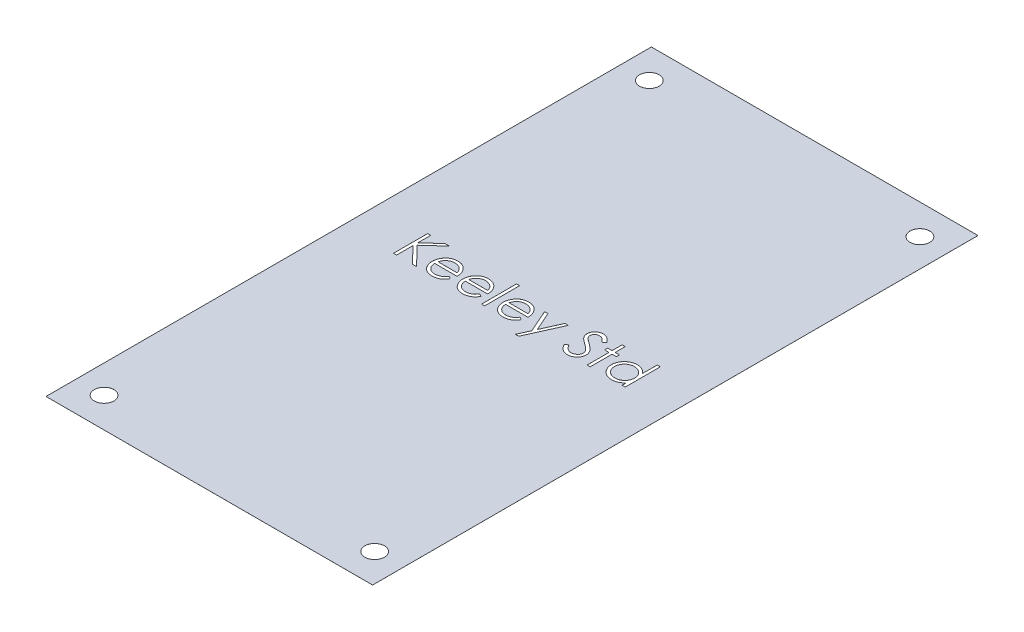
from build123d import *

# Parameters (mm, degrees)
SKETCH2_W           = 60.706
SKETCH2_H           = 112.522
BOSS_EXTRUDE1_DEPTH = 0.00254
SKETCH3_R           = 1.8288
CUT_EXTRUDE1_DEPTH  = 64.926557364
SKETCH5_W           = 0.569871795
SKETCH5_H           = 6.512820513
CUT_EXTRUDE2_DEPTH  = 2.54


with BuildPart() as part:
    # Sketch2 → Boss-Extrude1 (new body)
    with BuildSketch(Plane(origin=(0, 0, 0), x_dir=(1, 0, 0), z_dir=(0, 1, 0))):
        Rectangle(SKETCH2_W, SKETCH2_H)
    extrude(amount=BOSS_EXTRUDE1_DEPTH)

    # Sketch3 → Cut-Extrude1 (cut, through all)
    with BuildSketch(Plane(origin=(0, 0.00254, 0), x_dir=(1, 0, 0), z_dir=(0, 1, 0))):
        with Locations(Location((-25.146, 50.673, 0), (0, 0, 270))):
            Circle(SKETCH3_R)
        with Locations(Location((25.146, 50.673, 0), (0, 0, 270))):
            Circle(SKETCH3_R)
        with Locations(Location((25.146, -50.673, 0), (0, 0, 270))):
            Circle(SKETCH3_R)
        with Locations(Location((-25.146, -50.673, 0), (0, 0, 270))):
            Circle(SKETCH3_R)
    extrude(amount=-CUT_EXTRUDE1_DEPTH, mode=Mode.SUBTRACT)

    # Sketch5 → Cut-Extrude2 (cut)
    # profile 1 of 9: a face of its own
    with BuildSketch(Plane(origin=(0, 0.00254, 0), x_dir=(1, 0, 0), z_dir=(0, 1, 0))):
        Polygon((-21.106420198, 5.433262099), (-20.536548403, 5.433262099), (-20.536548403, 3.015123076), (-17.889443034, 5.433262099), (-17.076612505, 5.433262099), (-20.196914989, 2.583903125), (-16.832381736, -0.916737901), (-17.591786784, -0.916737901), (-20.536548403, 2.147595032), (-20.536548403, -0.916737901), (-21.106420198, -0.916737901), align=None)
    # profile 2 of 9: a face of its own
    with BuildSketch(Plane(origin=(0, 0.00254, 0), x_dir=(1, 0, 0), z_dir=(0, 1, 0))):
        with BuildLine():
            Line((-12.250510742, 0.548646714), (-11.74424071, 0.282791346))
            add(Edge.make_bspline(
                [(-11.74424071, 0.282791346), (-11.784584248, 0.211229873), (-11.863076794, 0.071999587), (-11.998061008, -0.119283932), (-12.139560911, -0.291364787), (-12.293963825, -0.439645732), (-12.456650242, -0.568916102), (-12.628522345, -0.682014726), (-12.810474914, -0.778386899), (-13.002516557, -0.859580771), (-13.206260029, -0.922009425), (-13.422199066, -0.966104225), (-13.65074735, -0.993360727), (-13.807403991, -0.996526911), (-13.887620117, -0.998148158)],
                knots=[0, 0, 0, 0, 1.120438281, 2.179929193, 3.190490725, 4.156257408, 5.095198341, 6.022838206, 6.959905092, 7.901321166, 8.864066838, 9.862729781, 10.905609505, 12, 12, 12, 12], degree=3))
            add(Edge.make_bspline(
                [(-13.887620117, -0.998148158), (-13.976777705, -0.996066854), (-14.15069833, -0.992006833), (-14.4038633, -0.95700479), (-14.642223102, -0.89990494), (-14.865764335, -0.820138886), (-15.073939565, -0.715949312), (-15.267162544, -0.589022824), (-15.446449398, -0.440011447), (-15.606150463, -0.267624471), (-15.749921508, -0.083144349), (-15.876786924, 0.109089899), (-15.982845406, 0.308594606), (-16.069119427, 0.5140997), (-16.138796825, 0.724309907), (-16.187359274, 0.941137855), (-16.215353245, 1.163996701), (-16.219643025, 1.31475901), (-16.221804813, 1.390734054)],
                knots=[0, 0, 0, 0, 1.145258523, 2.234067595, 3.276747158, 4.290159414, 5.277019952, 6.260822364, 7.254936242, 8.264827045, 9.274100331, 10.257902744, 11.220704747, 12.172965371, 13.118907548, 14.062713208, 15.023725156, 16, 16, 16, 16], degree=3))
            add(Edge.make_bspline(
                [(-16.221804813, 1.390734054), (-16.219883228, 1.462026103), (-16.2160749, 1.603317531), (-16.192070472, 1.812442162), (-16.149528569, 2.015693783), (-16.091151524, 2.213241281), (-16.015765691, 2.404753896), (-15.923541522, 2.590348182), (-15.814335351, 2.769826651), (-15.730020643, 2.883043765), (-15.687550005, 2.940072996)],
                knots=[0, 0, 0, 0, 1.024358464, 2.0301432, 3.019427413, 4.004406732, 4.986367066, 5.972626655, 6.978780325, 8, 8, 8, 8], degree=3))
            add(Edge.make_bspline(
                [(-15.687550005, 2.940072996), (-15.630023209, 3.008777946), (-15.516791921, 3.144011448), (-15.325282533, 3.321699553), (-15.11790932, 3.470550402), (-14.897271084, 3.593934778), (-14.660803481, 3.687685538), (-14.411685196, 3.757549294), (-14.147079632, 3.796697971), (-13.966185874, 3.802227612), (-13.87362773, 3.805056971)],
                knots=[0, 0, 0, 0, 1.030682036, 2.02871468, 2.997146059, 3.962720338, 4.930598197, 5.918074684, 6.934738563, 8, 8, 8, 8], degree=3))
            add(Edge.make_bspline(
                [(-13.87362773, 3.805056971), (-13.778472789, 3.802600339), (-13.591800485, 3.797780988), (-13.319599351, 3.753101783), (-13.062042051, 3.682249291), (-12.819231651, 3.582184557), (-12.591143532, 3.453080799), (-12.379260271, 3.293166315), (-12.179958241, 3.107350642), (-12.064009819, 2.964451677), (-12.005007938, 2.891735657)],
                knots=[0, 0, 0, 0, 1.056321875, 2.072262726, 3.055038591, 4.01806755, 4.982017516, 5.957941055, 6.960871419, 8, 8, 8, 8], degree=3))
            add(Edge.make_bspline(
                [(-12.005007938, 2.891735657), (-11.96486335, 2.83693773), (-11.884841388, 2.727706629), (-11.784607364, 2.549596101), (-11.697598947, 2.363249737), (-11.628052004, 2.165655341), (-11.57173748, 1.959154103), (-11.530994395, 1.742269772), (-11.507100944, 1.515066933), (-11.502404307, 1.360260182), (-11.500009941, 1.281339022)],
                knots=[0, 0, 0, 0, 0.94817472, 1.890038105, 2.849395472, 3.817997239, 4.812318967, 5.836947057, 6.897266129, 8, 8, 8, 8], degree=3))
            Line((-11.500009941, 1.281339022), (-15.651933018, 1.281339022))
            add(Edge.make_bspline(
                [(-15.651933018, 1.281339022), (-15.649139732, 1.220196751), (-15.643646848, 1.099962941), (-15.618037945, 0.924030235), (-15.577672313, 0.7564386), (-15.520941299, 0.598445081), (-15.452240023, 0.447986135), (-15.36808308, 0.306177868), (-15.267681317, 0.173666195), (-15.155693263, 0.049265817), (-15.031038961, -0.06151585), (-14.899897406, -0.160669787), (-14.760390509, -0.243774226), (-14.613618272, -0.311229169), (-14.459818033, -0.364036343), (-14.298941336, -0.400082246), (-14.131304754, -0.42422514), (-14.017030636, -0.426909675), (-13.958854092, -0.428276363)],
                knots=[0, 0, 0, 0, 1.094153842, 2.151609401, 3.174256925, 4.172055639, 5.149267565, 6.128595816, 7.11444997, 8.118368179, 9.117203808, 10.09244225, 11.054858984, 12.015122123, 12.976791628, 13.957293641, 14.960065497, 16, 16, 16, 16], degree=3))
            add(Edge.make_bspline(
                [(-13.958854092, -0.428276363), (-13.901974153, -0.427173174), (-13.789113442, -0.424984237), (-13.621036458, -0.403699198), (-13.455683315, -0.369281698), (-13.293738389, -0.322309859), (-13.138488425, -0.265020427), (-12.994714356, -0.195890957), (-12.862488822, -0.119419274), (-12.738905182, -0.031953149), (-12.619033523, 0.075104562), (-12.500120726, 0.208700798), (-12.372618798, 0.366702456), (-12.292809108, 0.485621021), (-12.250510742, 0.548646714)],
                knots=[0, 0, 0, 0, 0.99110716, 1.966546729, 2.947904876, 3.932708344, 4.903319531, 5.828989031, 6.710028674, 7.56322171, 8.463672341, 9.504779593, 10.677557249, 12, 12, 12, 12], degree=3))
        make_face()
        with BuildLine():
            add(Edge.make_bspline(
                [(-12.069881736, 1.851210817), (-12.090739898, 1.926799173), (-12.130885145, 2.072282428), (-12.21477112, 2.273742329), (-12.309243773, 2.452790378), (-12.4210432, 2.608056284), (-12.547714316, 2.745948372), (-12.694027719, 2.866450662), (-12.858104268, 2.974250895), (-13.039095852, 3.065241858), (-13.230760234, 3.142693459), (-13.431431468, 3.194627597), (-13.63618774, 3.23020491), (-13.774679945, 3.233517992), (-13.844370919, 3.235185176)],
                knots=[0, 0, 0, 0, 1.154881502, 2.222775134, 3.210006277, 4.132804581, 5.035138423, 5.962687519, 6.919655026, 7.923214229, 8.944639381, 9.960483929, 10.97369054, 12, 12, 12, 12], degree=3))
            add(Edge.make_bspline(
                [(-13.844370919, 3.235185176), (-13.901247757, 3.234075429), (-14.013681309, 3.231881692), (-14.179327533, 3.211071601), (-14.338403558, 3.176673025), (-14.492083151, 3.129565175), (-14.638352441, 3.066775282), (-14.780220092, 2.993145714), (-14.914078811, 2.903263126), (-14.997792304, 2.834757775), (-15.04008406, 2.800149118)],
                knots=[0, 0, 0, 0, 1.04873581, 2.073130211, 3.073294108, 4.04793562, 5.032784715, 6.005352987, 6.992311501, 8, 8, 8, 8], degree=3))
            add(Edge.make_bspline(
                [(-15.04008406, 2.800149118), (-15.070370443, 2.772763717), (-15.131662701, 2.717342339), (-15.213560504, 2.621857922), (-15.29197479, 2.518894373), (-15.363337274, 2.404512504), (-15.428792324, 2.280014805), (-15.490042568, 2.146451381), (-15.545172202, 2.002808702), (-15.57618943, 1.902710134), (-15.592147361, 1.851210817)],
                knots=[0, 0, 0, 0, 0.879870761, 1.780643979, 2.707998968, 3.669668524, 4.684282772, 5.740141944, 6.837334558, 8, 8, 8, 8], degree=3))
            Line((-15.592147361, 1.851210817), (-12.069881736, 1.851210817))
        make_face(mode=Mode.SUBTRACT)
    # profile 3 of 9: a face of its own
    with BuildSketch(Plane(origin=(0, 0.00254, 0), x_dir=(1, 0, 0), z_dir=(0, 1, 0))):
        with BuildLine():
            Line((-6.551792794, 0.548646714), (-6.045522762, 0.282791346))
            add(Edge.make_bspline(
                [(-6.045522762, 0.282791346), (-6.085866299, 0.211229873), (-6.164358846, 0.071999587), (-6.29934306, -0.119283932), (-6.440842963, -0.291364787), (-6.595245876, -0.439645732), (-6.757932294, -0.568916102), (-6.929804396, -0.682014726), (-7.111756965, -0.778386899), (-7.303798609, -0.859580771), (-7.50754208, -0.922009425), (-7.723481117, -0.966104225), (-7.952029402, -0.993360727), (-8.108686042, -0.996526911), (-8.188902169, -0.998148158)],
                knots=[0, 0, 0, 0, 1.120438281, 2.179929193, 3.190490725, 4.156257408, 5.095198341, 6.022838206, 6.959905092, 7.901321166, 8.864066838, 9.862729781, 10.905609505, 12, 12, 12, 12], degree=3))
            add(Edge.make_bspline(
                [(-8.188902169, -0.998148158), (-8.278059757, -0.996066854), (-8.451980381, -0.992006833), (-8.705145351, -0.95700479), (-8.943505153, -0.89990494), (-9.167046386, -0.820138886), (-9.375221616, -0.715949312), (-9.568444595, -0.589022824), (-9.747731449, -0.440011447), (-9.907432515, -0.267624471), (-10.051203559, -0.083144349), (-10.178068975, 0.109089899), (-10.284127457, 0.308594606), (-10.370401479, 0.5140997), (-10.440078877, 0.724309907), (-10.488641325, 0.941137855), (-10.516635296, 1.163996701), (-10.520925076, 1.31475901), (-10.523086864, 1.390734054)],
                knots=[0, 0, 0, 0, 1.145258523, 2.234067595, 3.276747158, 4.290159414, 5.277019952, 6.260822364, 7.254936242, 8.264827045, 9.274100331, 10.257902744, 11.220704747, 12.172965371, 13.118907548, 14.062713208, 15.023725156, 16, 16, 16, 16], degree=3))
            add(Edge.make_bspline(
                [(-10.523086864, 1.390734054), (-10.521165279, 1.462026103), (-10.517356952, 1.603317531), (-10.493352523, 1.812442162), (-10.45081062, 2.015693783), (-10.392433575, 2.213241281), (-10.317047743, 2.404753896), (-10.224823574, 2.590348182), (-10.115617402, 2.769826651), (-10.031302694, 2.883043765), (-9.988832057, 2.940072996)],
                knots=[0, 0, 0, 0, 1.024358464, 2.0301432, 3.019427413, 4.004406732, 4.986367066, 5.972626655, 6.978780325, 8, 8, 8, 8], degree=3))
            add(Edge.make_bspline(
                [(-9.988832057, 2.940072996), (-9.931305261, 3.008777946), (-9.818073972, 3.144011448), (-9.626564584, 3.321699553), (-9.419191371, 3.470550402), (-9.198553135, 3.593934778), (-8.962085532, 3.687685538), (-8.712967247, 3.757549294), (-8.448361683, 3.796697971), (-8.267467925, 3.802227612), (-8.174909781, 3.805056971)],
                knots=[0, 0, 0, 0, 1.030682036, 2.02871468, 2.997146059, 3.962720338, 4.930598197, 5.918074684, 6.934738563, 8, 8, 8, 8], degree=3))
            add(Edge.make_bspline(
                [(-8.174909781, 3.805056971), (-8.07975484, 3.802600339), (-7.893082537, 3.797780988), (-7.620881403, 3.753101783), (-7.363324103, 3.682249291), (-7.120513702, 3.582184557), (-6.892425583, 3.453080799), (-6.680542322, 3.293166315), (-6.481240292, 3.107350642), (-6.36529187, 2.964451677), (-6.306289989, 2.891735657)],
                knots=[0, 0, 0, 0, 1.056321875, 2.072262726, 3.055038591, 4.01806755, 4.982017516, 5.957941055, 6.960871419, 8, 8, 8, 8], degree=3))
            add(Edge.make_bspline(
                [(-6.306289989, 2.891735657), (-6.266145401, 2.83693773), (-6.186123439, 2.727706629), (-6.085889415, 2.549596101), (-5.998880998, 2.363249737), (-5.929334055, 2.165655341), (-5.873019531, 1.959154103), (-5.832276446, 1.742269772), (-5.808382995, 1.515066933), (-5.803686358, 1.360260182), (-5.801291992, 1.281339022)],
                knots=[0, 0, 0, 0, 0.94817472, 1.890038105, 2.849395472, 3.817997239, 4.812318967, 5.836947057, 6.897266129, 8, 8, 8, 8], degree=3))
            Line((-5.801291992, 1.281339022), (-9.953215069, 1.281339022))
            add(Edge.make_bspline(
                [(-9.953215069, 1.281339022), (-9.950421783, 1.220196751), (-9.944928899, 1.099962941), (-9.919319997, 0.924030235), (-9.878954364, 0.7564386), (-9.822223351, 0.598445081), (-9.753522074, 0.447986135), (-9.669365131, 0.306177868), (-9.568963369, 0.173666195), (-9.456975314, 0.049265817), (-9.332321013, -0.06151585), (-9.201179457, -0.160669787), (-9.06167256, -0.243774226), (-8.914900323, -0.311229169), (-8.761100085, -0.364036343), (-8.600223388, -0.400082246), (-8.432586805, -0.42422514), (-8.318312688, -0.426909675), (-8.260136143, -0.428276363)],
                knots=[0, 0, 0, 0, 1.094153842, 2.151609401, 3.174256925, 4.172055639, 5.149267565, 6.128595816, 7.11444997, 8.118368179, 9.117203808, 10.09244225, 11.054858984, 12.015122123, 12.976791628, 13.957293641, 14.960065497, 16, 16, 16, 16], degree=3))
            add(Edge.make_bspline(
                [(-8.260136143, -0.428276363), (-8.203256204, -0.427173174), (-8.090395493, -0.424984237), (-7.922318509, -0.403699198), (-7.756965367, -0.369281698), (-7.59502044, -0.322309859), (-7.439770477, -0.265020427), (-7.295996407, -0.195890957), (-7.163770873, -0.119419274), (-7.040187234, -0.031953149), (-6.920315574, 0.075104562), (-6.801402778, 0.208700798), (-6.673900849, 0.366702456), (-6.59409116, 0.485621021), (-6.551792794, 0.548646714)],
                knots=[0, 0, 0, 0, 0.99110716, 1.966546729, 2.947904876, 3.932708344, 4.903319531, 5.828989031, 6.710028674, 7.56322171, 8.463672341, 9.504779593, 10.677557249, 12, 12, 12, 12], degree=3))
        make_face()
        with BuildLine():
            add(Edge.make_bspline(
                [(-6.371163787, 1.851210817), (-6.392021949, 1.926799173), (-6.432167196, 2.072282428), (-6.516053172, 2.273742329), (-6.610525824, 2.452790378), (-6.722325251, 2.608056284), (-6.848996367, 2.745948372), (-6.99530977, 2.866450662), (-7.15938632, 2.974250895), (-7.340377904, 3.065241858), (-7.532042285, 3.142693459), (-7.732713519, 3.194627597), (-7.937469791, 3.23020491), (-8.075961997, 3.233517992), (-8.14565297, 3.235185176)],
                knots=[0, 0, 0, 0, 1.154881502, 2.222775134, 3.210006277, 4.132804581, 5.035138423, 5.962687519, 6.919655026, 7.923214229, 8.944639381, 9.960483929, 10.97369054, 12, 12, 12, 12], degree=3))
            add(Edge.make_bspline(
                [(-8.14565297, 3.235185176), (-8.202529808, 3.234075429), (-8.31496336, 3.231881692), (-8.480609584, 3.211071601), (-8.639685609, 3.176673025), (-8.793365202, 3.129565175), (-8.939634492, 3.066775282), (-9.081502143, 2.993145714), (-9.215360862, 2.903263126), (-9.299074355, 2.834757775), (-9.341366111, 2.800149118)],
                knots=[0, 0, 0, 0, 1.04873581, 2.073130211, 3.073294108, 4.04793562, 5.032784715, 6.005352987, 6.992311501, 8, 8, 8, 8], degree=3))
            add(Edge.make_bspline(
                [(-9.341366111, 2.800149118), (-9.371652494, 2.772763717), (-9.432944752, 2.717342339), (-9.514842555, 2.621857922), (-9.593256841, 2.518894373), (-9.664619326, 2.404512504), (-9.730074375, 2.280014805), (-9.79132462, 2.146451381), (-9.846454253, 2.002808702), (-9.877471481, 1.902710134), (-9.893429412, 1.851210817)],
                knots=[0, 0, 0, 0, 0.879870761, 1.780643979, 2.707998968, 3.669668524, 4.684282772, 5.740141944, 6.837334558, 8, 8, 8, 8], degree=3))
            Line((-9.893429412, 1.851210817), (-6.371163787, 1.851210817))
        make_face(mode=Mode.SUBTRACT)
    # profile 4 of 9: a face of its own
    with BuildSketch(Plane(origin=(0, 0.00254, 0), x_dir=(1, 0, 0), z_dir=(0, 1, 0))):
        with Locations((-4.458022762, 2.339672355)):
            Rectangle(SKETCH5_W, SKETCH5_H)
    # profile 5 of 9: a face of its own
    with BuildSketch(Plane(origin=(0, 0.00254, 0), x_dir=(1, 0, 0), z_dir=(0, 1, 0))):
        with BuildLine():
            Line((0.937950796, 0.548646714), (1.444220828, 0.282791346))
            add(Edge.make_bspline(
                [(1.444220828, 0.282791346), (1.403877291, 0.211229873), (1.325384744, 0.071999587), (1.19040053, -0.119283932), (1.048900627, -0.291364787), (0.894497714, -0.439645732), (0.731811296, -0.568916102), (0.559939194, -0.682014726), (0.377986625, -0.778386899), (0.185944981, -0.859580771), (-0.01779849, -0.922009425), (-0.233737527, -0.966104225), (-0.462285812, -0.993360727), (-0.618942452, -0.996526911), (-0.699158579, -0.998148158)],
                knots=[0, 0, 0, 0, 1.120438281, 2.179929193, 3.190490725, 4.156257408, 5.095198341, 6.022838206, 6.959905092, 7.901321166, 8.864066838, 9.862729781, 10.905609505, 12, 12, 12, 12], degree=3))
            add(Edge.make_bspline(
                [(-0.699158579, -0.998148158), (-0.788316167, -0.996066854), (-0.962236792, -0.992006833), (-1.215401761, -0.95700479), (-1.453761563, -0.89990494), (-1.677302796, -0.820138886), (-1.885478026, -0.715949312), (-2.078701006, -0.589022824), (-2.25798786, -0.440011447), (-2.417688925, -0.267624471), (-2.561459969, -0.083144349), (-2.688325386, 0.109089899), (-2.794383868, 0.308594606), (-2.880657889, 0.5140997), (-2.950335287, 0.724309907), (-2.998897735, 0.941137855), (-3.026891706, 1.163996701), (-3.031181486, 1.31475901), (-3.033343275, 1.390734054)],
                knots=[0, 0, 0, 0, 1.145258523, 2.234067595, 3.276747158, 4.290159414, 5.277019952, 6.260822364, 7.254936242, 8.264827045, 9.274100331, 10.257902744, 11.220704747, 12.172965371, 13.118907548, 14.062713208, 15.023725156, 16, 16, 16, 16], degree=3))
            add(Edge.make_bspline(
                [(-3.033343275, 1.390734054), (-3.03142169, 1.462026103), (-3.027613362, 1.603317531), (-3.003608933, 1.812442162), (-2.96106703, 2.015693783), (-2.902689985, 2.213241281), (-2.827304153, 2.404753896), (-2.735079984, 2.590348182), (-2.625873813, 2.769826651), (-2.541559105, 2.883043765), (-2.499088467, 2.940072996)],
                knots=[0, 0, 0, 0, 1.024358464, 2.0301432, 3.019427413, 4.004406732, 4.986367066, 5.972626655, 6.978780325, 8, 8, 8, 8], degree=3))
            add(Edge.make_bspline(
                [(-2.499088467, 2.940072996), (-2.441561671, 3.008777946), (-2.328330382, 3.144011448), (-2.136820995, 3.321699553), (-1.929447781, 3.470550402), (-1.708809545, 3.593934778), (-1.472341942, 3.687685538), (-1.223223657, 3.757549294), (-0.958618094, 3.796697971), (-0.777724336, 3.802227612), (-0.685166191, 3.805056971)],
                knots=[0, 0, 0, 0, 1.030682036, 2.02871468, 2.997146059, 3.962720338, 4.930598197, 5.918074684, 6.934738563, 8, 8, 8, 8], degree=3))
            add(Edge.make_bspline(
                [(-0.685166191, 3.805056971), (-0.59001125, 3.802600339), (-0.403338947, 3.797780988), (-0.131137813, 3.753101783), (0.126419487, 3.682249291), (0.369229888, 3.582184557), (0.597318007, 3.453080799), (0.809201268, 3.293166315), (1.008503298, 3.107350642), (1.124451719, 2.964451677), (1.1834536, 2.891735657)],
                knots=[0, 0, 0, 0, 1.056321875, 2.072262726, 3.055038591, 4.01806755, 4.982017516, 5.957941055, 6.960871419, 8, 8, 8, 8], degree=3))
            add(Edge.make_bspline(
                [(1.1834536, 2.891735657), (1.223598189, 2.83693773), (1.30362015, 2.727706629), (1.403854175, 2.549596101), (1.490862591, 2.363249737), (1.560409535, 2.165655341), (1.616724058, 1.959154103), (1.657467144, 1.742269772), (1.681360595, 1.515066933), (1.686057231, 1.360260182), (1.688451597, 1.281339022)],
                knots=[0, 0, 0, 0, 0.94817472, 1.890038105, 2.849395472, 3.817997239, 4.812318967, 5.836947057, 6.897266129, 8, 8, 8, 8], degree=3))
            Line((1.688451597, 1.281339022), (-2.46347148, 1.281339022))
            add(Edge.make_bspline(
                [(-2.46347148, 1.281339022), (-2.460678194, 1.220196751), (-2.45518531, 1.099962941), (-2.429576407, 0.924030235), (-2.389210775, 0.7564386), (-2.332479761, 0.598445081), (-2.263778484, 0.447986135), (-2.179621541, 0.306177868), (-2.079219779, 0.173666195), (-1.967231724, 0.049265817), (-1.842577423, -0.06151585), (-1.711435867, -0.160669787), (-1.571928971, -0.243774226), (-1.425156734, -0.311229169), (-1.271356495, -0.364036343), (-1.110479798, -0.400082246), (-0.942843215, -0.42422514), (-0.828569098, -0.426909675), (-0.770392553, -0.428276363)],
                knots=[0, 0, 0, 0, 1.094153842, 2.151609401, 3.174256925, 4.172055639, 5.149267565, 6.128595816, 7.11444997, 8.118368179, 9.117203808, 10.09244225, 11.054858984, 12.015122123, 12.976791628, 13.957293641, 14.960065497, 16, 16, 16, 16], degree=3))
            add(Edge.make_bspline(
                [(-0.770392553, -0.428276363), (-0.713512614, -0.427173174), (-0.600651903, -0.424984237), (-0.432574919, -0.403699198), (-0.267221777, -0.369281698), (-0.10527685, -0.322309859), (0.049973113, -0.265020427), (0.193747183, -0.195890957), (0.325972717, -0.119419274), (0.449556356, -0.031953149), (0.569428015, 0.075104562), (0.688340812, 0.208700798), (0.81584274, 0.366702456), (0.89565243, 0.485621021), (0.937950796, 0.548646714)],
                knots=[0, 0, 0, 0, 0.99110716, 1.966546729, 2.947904876, 3.932708344, 4.903319531, 5.828989031, 6.710028674, 7.56322171, 8.463672341, 9.504779593, 10.677557249, 12, 12, 12, 12], degree=3))
        make_face()
        with BuildLine():
            add(Edge.make_bspline(
                [(1.118579802, 1.851210817), (1.097721641, 1.926799173), (1.057576394, 2.072282428), (0.973690418, 2.273742329), (0.879217766, 2.452790378), (0.767418339, 2.608056284), (0.640747222, 2.745948372), (0.49443382, 2.866450662), (0.33035727, 2.974250895), (0.149365686, 3.065241858), (-0.042298695, 3.142693459), (-0.242969929, 3.194627597), (-0.447726202, 3.23020491), (-0.586218407, 3.233517992), (-0.65590938, 3.235185176)],
                knots=[0, 0, 0, 0, 1.154881502, 2.222775134, 3.210006277, 4.132804581, 5.035138423, 5.962687519, 6.919655026, 7.923214229, 8.944639381, 9.960483929, 10.97369054, 12, 12, 12, 12], degree=3))
            add(Edge.make_bspline(
                [(-0.65590938, 3.235185176), (-0.712786219, 3.234075429), (-0.825219771, 3.231881692), (-0.990865994, 3.211071601), (-1.14994202, 3.176673025), (-1.303621613, 3.129565175), (-1.449890903, 3.066775282), (-1.591758553, 2.993145714), (-1.725617272, 2.903263126), (-1.809330766, 2.834757775), (-1.851622521, 2.800149118)],
                knots=[0, 0, 0, 0, 1.04873581, 2.073130211, 3.073294108, 4.04793562, 5.032784715, 6.005352987, 6.992311501, 8, 8, 8, 8], degree=3))
            add(Edge.make_bspline(
                [(-1.851622521, 2.800149118), (-1.881908904, 2.772763717), (-1.943201162, 2.717342339), (-2.025098965, 2.621857922), (-2.103513252, 2.518894373), (-2.174875736, 2.404512504), (-2.240330786, 2.280014805), (-2.30158103, 2.146451381), (-2.356710663, 2.002808702), (-2.387727891, 1.902710134), (-2.403685823, 1.851210817)],
                knots=[0, 0, 0, 0, 0.879870761, 1.780643979, 2.707998968, 3.669668524, 4.684282772, 5.740141944, 6.837334558, 8, 8, 8, 8], degree=3))
            Line((-2.403685823, 1.851210817), (1.118579802, 1.851210817))
        make_face(mode=Mode.SUBTRACT)
    # profile 6 of 9: a face of its own
    with BuildSketch(Plane(origin=(0, 0.00254, 0), x_dir=(1, 0, 0), z_dir=(0, 1, 0))):
        Polygon((2.339733649, 3.723646714), (2.954126677, 3.723646714), (4.525090219, 0.169580208), (6.120222431, 3.723646714), (6.735887495, 3.723646714), (3.88652852, -2.626353286), (3.270863456, -2.626353286), (4.215985652, -0.521134936), align=None)
    # profile 7 of 9: a face of its own
    with BuildSketch(Plane(origin=(0, 0.00254, 0), x_dir=(1, 0, 0), z_dir=(0, 1, 0))):
        with BuildLine():
            Line((9.422425956, 0.308232051), (9.959224834, 0.630056971))
            add(Edge.make_bspline(
                [(9.959224834, 0.630056971), (10.009150779, 0.546483015), (10.104806963, 0.386358541), (10.264375857, 0.169990382), (10.429716996, -0.013909531), (10.602054787, -0.164271376), (10.780337293, -0.282651499), (10.965728362, -0.366475548), (11.157603247, -0.41875596), (11.288184323, -0.425106117), (11.353375475, -0.428276363)],
                knots=[0, 0, 0, 0, 1.272034388, 2.437168799, 3.508375237, 4.49857839, 5.41946034, 6.295179144, 7.148887113, 8, 8, 8, 8], degree=3))
            add(Edge.make_bspline(
                [(11.353375475, -0.428276363), (11.409050208, -0.426725743), (11.519425496, -0.423651634), (11.681916994, -0.394113608), (11.839726836, -0.34873446), (11.989602507, -0.283745055), (12.129475979, -0.20511666), (12.25213384, -0.110145738), (12.358171789, -0.003817336), (12.444911182, 0.11480548), (12.511459246, 0.242380878), (12.562607713, 0.373328676), (12.590992347, 0.509705935), (12.595268171, 0.601527775), (12.597425956, 0.647865464)],
                knots=[0, 0, 0, 0, 1.095163259, 2.171163733, 3.241058638, 4.321873601, 5.38011039, 6.391990106, 7.366004449, 8.327778327, 9.272591725, 10.192022065, 11.087607919, 12, 12, 12, 12], degree=3))
            add(Edge.make_bspline(
                [(12.597425956, 0.647865464), (12.594751135, 0.700735292), (12.589313615, 0.808211925), (12.543355073, 0.966779867), (12.471057154, 1.123702101), (12.404359215, 1.220768683), (12.369731645, 1.27116274)],
                knots=[0, 0, 0, 0, 0.938893495, 1.908633276, 2.914225137, 4, 4, 4, 4], degree=3))
            add(Edge.make_bspline(
                [(12.369731645, 1.27116274), (12.341300674, 1.307533406), (12.281613406, 1.383889069), (12.179001919, 1.497545424), (12.058594825, 1.614781699), (11.924512662, 1.740074559), (11.7718712, 1.867596705), (11.605451281, 2.003429152), (11.421003994, 2.142406299), (11.291646336, 2.235610811), (11.224899915, 2.283702804)],
                knots=[0, 0, 0, 0, 0.722233717, 1.516239348, 2.393582979, 3.351407094, 4.387010283, 5.505090956, 6.712668013, 8, 8, 8, 8], degree=3))
            add(Edge.make_bspline(
                [(11.224899915, 2.283702804), (11.158090664, 2.331288956), (11.030356465, 2.422270054), (10.851724466, 2.55729697), (10.691986655, 2.68074799), (10.55185301, 2.793785269), (10.43138517, 2.896424138), (10.329633839, 2.98767897), (10.249191028, 3.070017716), (10.20445876, 3.123432722), (10.184375075, 3.147414743)],
                knots=[0, 0, 0, 0, 1.452282411, 2.77665338, 3.964542531, 5.026858415, 5.96415736, 6.766646006, 7.446254459, 8, 8, 8, 8], degree=3))
            add(Edge.make_bspline(
                [(10.184375075, 3.147414743), (10.156303457, 3.18479091), (10.101096853, 3.258296158), (10.028224243, 3.373185543), (9.966286048, 3.490793467), (9.917731531, 3.611435965), (9.876844391, 3.733419336), (9.849343574, 3.858335167), (9.832123468, 3.985622946), (9.830360007, 4.071281726), (9.829477238, 4.114161538)],
                knots=[0, 0, 0, 0, 1.068054152, 2.10047183, 3.106115577, 4.101338837, 5.06977816, 6.043150881, 7.020423561, 8, 8, 8, 8], degree=3))
            add(Edge.make_bspline(
                [(9.829477238, 4.114161538), (9.83184526, 4.181344129), (9.83653069, 4.31427333), (9.876155628, 4.508457837), (9.938699307, 4.693853194), (10.026320032, 4.868623942), (10.139272658, 5.028219365), (10.26998464, 5.174475263), (10.425671193, 5.297426833), (10.596490953, 5.404854425), (10.783464656, 5.488939175), (10.97939101, 5.552368382), (11.184581412, 5.588308035), (11.323561385, 5.593465623), (11.394080604, 5.596082612)],
                knots=[0, 0, 0, 0, 1.005424448, 1.989358655, 2.955360095, 3.929531133, 4.905563448, 5.876582895, 6.856512386, 7.866279853, 8.892233794, 9.918561126, 10.94386622, 12, 12, 12, 12], degree=3))
            add(Edge.make_bspline(
                [(11.394080604, 5.596082612), (11.468909186, 5.593501697), (11.617719352, 5.58836908), (11.836611501, 5.543742131), (12.047360229, 5.469899483), (12.216893009, 5.386100061), (12.349576734, 5.302404492), (12.450764406, 5.226168526), (12.55330321, 5.138402257), (12.658020252, 5.038871911), (12.763141163, 4.926664234), (12.870226569, 4.802547698), (12.979526885, 4.667280804), (13.049841088, 4.570716352), (13.085887495, 4.52121282)],
                knots=[0, 0, 0, 0, 1.286793592, 2.559021753, 3.825965368, 5.121522368, 5.803751409, 6.523245864, 7.299691795, 8.125521123, 9.008227632, 9.944561021, 10.946284179, 12, 12, 12, 12], degree=3))
            Line((13.085887495, 4.52121282), (12.570713216, 4.130697996))
            add(Edge.make_bspline(
                [(12.570713216, 4.130697996), (12.539605596, 4.170773192), (12.479699592, 4.247948648), (12.38875038, 4.356028035), (12.303027833, 4.454755077), (12.218572108, 4.540507523), (12.139843662, 4.617981394), (12.063431314, 4.684311238), (11.990434705, 4.740146961), (11.898419739, 4.799734563), (11.782817593, 4.858801362), (11.637702791, 4.908783261), (11.486053407, 4.938818873), (11.38276679, 4.942790141), (11.330478841, 4.94480056)],
                knots=[0, 0, 0, 0, 1.181633172, 2.275549214, 3.290209073, 4.226197932, 5.078386478, 5.862611352, 6.581680152, 7.217281963, 8.414376989, 9.595101626, 10.782541182, 12, 12, 12, 12], degree=3))
            add(Edge.make_bspline(
                [(11.330478841, 4.94480056), (11.264880579, 4.94260219), (11.13838051, 4.938362841), (10.958783939, 4.892062296), (10.797142103, 4.819160921), (10.658253878, 4.716989461), (10.542616791, 4.595938517), (10.458968316, 4.456639737), (10.408621589, 4.302820235), (10.40247791, 4.195520373), (10.399349033, 4.140874278)],
                knots=[0, 0, 0, 0, 1.14458467, 2.207223713, 3.21896685, 4.227309161, 5.202851033, 6.127160689, 7.046193047, 8, 8, 8, 8], degree=3))
            add(Edge.make_bspline(
                [(10.399349033, 4.140874278), (10.400062277, 4.106853739), (10.401489932, 4.038757029), (10.42140135, 3.938152306), (10.446981561, 3.837801734), (10.487517479, 3.738156476), (10.543479673, 3.637473853), (10.616967635, 3.534020129), (10.709520358, 3.426883458), (10.780417223, 3.357201508), (10.817848633, 3.320411538)],
                knots=[0, 0, 0, 0, 0.858281714, 1.717966888, 2.583508476, 3.4729293, 4.427298488, 5.488583878, 6.674047936, 8, 8, 8, 8], degree=3))
            add(Edge.make_bspline(
                [(10.817848633, 3.320411538), (10.831748551, 3.30800722), (10.864771576, 3.278537399), (10.925143612, 3.230291404), (11.004868403, 3.170777803), (11.101864111, 3.097140814), (11.217919182, 3.01172159), (11.353046377, 2.915612322), (11.505739443, 2.80569299), (11.614092062, 2.728844309), (11.67138429, 2.688210016)],
                knots=[0, 0, 0, 0, 0.420754252, 0.999615792, 1.744751191, 2.668019286, 3.750313428, 4.999500688, 6.413464383, 8, 8, 8, 8], degree=3))
            add(Edge.make_bspline(
                [(11.67138429, 2.688210016), (11.740301589, 2.638060692), (11.873750389, 2.540953477), (12.063629141, 2.395056457), (12.235793621, 2.252366934), (12.390848291, 2.113796133), (12.530324967, 1.980395164), (12.652676261, 1.850559109), (12.759148852, 1.725218141), (12.873774006, 1.564522182), (12.990900335, 1.367162215), (13.09148707, 1.125357411), (13.154911501, 0.882612658), (13.163205536, 0.719459683), (13.167297751, 0.638961217)],
                knots=[0, 0, 0, 0, 1.163667725, 2.253281268, 3.268753668, 4.215851969, 5.092017293, 5.902905408, 6.650798638, 7.335211899, 8.59617414, 9.77448103, 10.901945474, 12, 12, 12, 12], degree=3))
            add(Edge.make_bspline(
                [(13.167297751, 0.638961217), (13.166105515, 0.582031898), (13.163744195, 0.469278788), (13.136600822, 0.303716005), (13.096832287, 0.142914285), (13.036893305, -0.011138734), (12.963735576, -0.161261374), (12.870905383, -0.303515708), (12.763304298, -0.441050174), (12.63987161, -0.570197365), (12.504805473, -0.688754035), (12.36205077, -0.794216761), (12.211373846, -0.882152148), (12.0535921, -0.953908676), (11.888669289, -1.010030915), (11.716660881, -1.050694263), (11.53728334, -1.075651053), (11.415362466, -1.07824142), (11.353375475, -1.079558414)],
                knots=[0, 0, 0, 0, 0.983748083, 1.948392443, 2.894712957, 3.844097841, 4.80183111, 5.778335162, 6.776009319, 7.81870978, 8.863265674, 9.881300176, 10.883814829, 11.87499822, 12.874611388, 13.892143829, 14.928324115, 16, 16, 16, 16], degree=3))
            add(Edge.make_bspline(
                [(11.353375475, -1.079558414), (11.30541421, -1.078630984), (11.210095703, -1.076787806), (11.0691085, -1.060493197), (10.930969531, -1.03743888), (10.797412191, -1.000837353), (10.666715744, -0.956429124), (10.539448618, -0.901749577), (10.415549135, -0.836222655), (10.294322949, -0.761301681), (10.176078375, -0.674111202), (10.061924483, -0.572559287), (9.948115818, -0.459446728), (9.838011542, -0.331701849), (9.729384552, -0.19138847), (9.62437658, -0.037193808), (9.520814035, 0.130042248), (9.455834543, 0.247726046), (9.422425956, 0.308232051)],
                knots=[0, 0, 0, 0, 0.915332311, 1.819136955, 2.706846663, 3.586547465, 4.459518054, 5.340707479, 6.227863349, 7.133153174, 8.059268498, 9.028702269, 10.047606654, 11.120612155, 12.245963614, 13.433783089, 14.680604001, 16, 16, 16, 16], degree=3))
        make_face()
    # profile 8 of 9: a face of its own
    with BuildSketch(Plane(origin=(0, 0.00254, 0), x_dir=(1, 0, 0), z_dir=(0, 1, 0))):
        Polygon((14.876913136, 5.596082612), (15.446784931, 5.596082612), (15.446784931, 3.723646714), (16.260887495, 3.723646714), (16.260887495, 3.153774919), (15.446784931, 3.153774919), (15.446784931, -0.916737901), (14.876913136, -0.916737901), (14.876913136, 3.153774919), (14.062810572, 3.153774919), (14.062810572, 3.723646714), (14.876913136, 3.723646714), align=None)
    # profile 9 of 9: a face of its own
    with BuildSketch(Plane(origin=(0, 0.00254, 0), x_dir=(1, 0, 0), z_dir=(0, 1, 0))):
        with BuildLine():
            Line((21.959605443, 5.596082612), (21.959605443, -0.916737901))
            Line((21.959605443, -0.916737901), (21.389733649, -0.916737901))
            Line((21.389733649, -0.916737901), (21.389733649, -0.114083654))
            add(Edge.make_bspline(
                [(21.389733649, -0.114083654), (21.325473843, -0.186726918), (21.200070024, -0.328491159), (20.990626852, -0.513697387), (20.768616015, -0.66678377), (20.535115047, -0.790427189), (20.290334805, -0.883304205), (20.034817904, -0.949319094), (19.768460113, -0.991762195), (19.586573698, -0.996000406), (19.494401116, -0.998148158)],
                knots=[0, 0, 0, 0, 1.074387032, 2.096679803, 3.090159297, 4.057316773, 5.018401886, 5.985159533, 6.978961417, 8, 8, 8, 8], degree=3))
            add(Edge.make_bspline(
                [(19.494401116, -0.998148158), (19.412453543, -0.995923168), (19.2508493, -0.99153539), (19.013125117, -0.95749521), (18.78435775, -0.902829654), (18.564331026, -0.826809469), (18.354468705, -0.725969978), (18.152973958, -0.605245142), (17.960890645, -0.461479636), (17.781146567, -0.29712707), (17.615625652, -0.118610451), (17.470371629, 0.071790756), (17.34926247, 0.273253221), (17.247988895, 0.483226229), (17.169981241, 0.703326154), (17.115600505, 0.932791873), (17.08159998, 1.171352073), (17.077214016, 1.33380235), (17.074990059, 1.416174759)],
                knots=[0, 0, 0, 0, 1.033919861, 2.038935746, 3.024066025, 3.998881131, 4.97069526, 5.957263378, 6.95902576, 7.993208707, 9.027059324, 10.027763471, 11.009749337, 11.988697705, 12.965288445, 13.950418724, 14.960734635, 16, 16, 16, 16], degree=3))
            add(Edge.make_bspline(
                [(17.074990059, 1.416174759), (17.077263307, 1.496844621), (17.081757396, 1.656324587), (17.115236809, 1.890873082), (17.171535925, 2.116784784), (17.250544162, 2.333332381), (17.351857424, 2.5407779), (17.475098382, 2.73926806), (17.620275936, 2.929349681), (17.78764816, 3.106553192), (17.968958386, 3.270239164), (18.16292137, 3.412495575), (18.36471218, 3.535353286), (18.577460785, 3.632696022), (18.798018246, 3.71145254), (19.028348069, 3.765940925), (19.267491934, 3.798048922), (19.429853255, 3.802698509), (19.51220961, 3.805056971)],
                knots=[0, 0, 0, 0, 1.020392517, 2.01726096, 2.990465484, 3.961182959, 4.928053699, 5.906110375, 6.912531644, 7.948652711, 8.985773172, 9.998621852, 10.987621588, 11.969261332, 12.953316658, 13.946091881, 14.958173133, 16, 16, 16, 16], degree=3))
            add(Edge.make_bspline(
                [(19.51220961, 3.805056971), (19.606945818, 3.802213811), (19.792902467, 3.796633004), (20.064861213, 3.749994309), (20.32210445, 3.671684517), (20.566113155, 3.564476049), (20.795432629, 3.425137543), (21.01174382, 3.256859916), (21.211284991, 3.054880666), (21.329343869, 2.903185382), (21.389733649, 2.825589823)],
                knots=[0, 0, 0, 0, 1.031072012, 2.023879775, 2.993683497, 3.952812103, 4.918022106, 5.908088563, 6.929940113, 8, 8, 8, 8], degree=3))
            Line((21.389733649, 2.825589823), (21.389733649, 5.596082612))
            Line((21.389733649, 5.596082612), (21.959605443, 5.596082612))
        make_face()
        with BuildLine():
            add(Edge.make_bspline(
                [(19.519841822, 3.235185176), (19.436540094, 3.23222129), (19.272115734, 3.226371051), (19.030735902, 3.180699139), (18.799752994, 3.104708518), (18.580322259, 3.000782783), (18.375909923, 2.870102075), (18.193222835, 2.712038994), (18.030766791, 2.530906125), (17.894136083, 2.327520868), (17.782756181, 2.109483474), (17.704438852, 1.88156485), (17.652787503, 1.64787582), (17.647510616, 1.489374947), (17.644861854, 1.409814583)],
                knots=[0, 0, 0, 0, 1.031046209, 2.035121221, 3.029706178, 4.034933723, 5.034054252, 6.02443088, 7.017295772, 8.038157696, 9.050218397, 10.03989886, 11.016116709, 12, 12, 12, 12], degree=3))
            add(Edge.make_bspline(
                [(17.644861854, 1.409814583), (17.648245303, 1.330729674), (17.65499894, 1.172869843), (17.703532342, 0.938862225), (17.784957255, 0.710889891), (17.896067855, 0.490887803), (18.035199303, 0.286628078), (18.196468715, 0.102042427), (18.381435654, -0.056688683), (18.586318417, -0.189562566), (18.805135735, -0.296900283), (19.035248725, -0.371586515), (19.272331668, -0.419806202), (19.433535188, -0.42543861), (19.514753681, -0.428276363)],
                knots=[0, 0, 0, 0, 0.979072187, 1.954306742, 2.945804271, 3.96968567, 4.997920485, 5.998718438, 6.996577872, 8.005894225, 9.015743152, 10.005417472, 10.995077863, 12, 12, 12, 12], degree=3))
            add(Edge.make_bspline(
                [(19.514753681, -0.428276363), (19.597206621, -0.425264714), (19.761197343, -0.419274843), (20.003293284, -0.373407405), (20.238234145, -0.29762687), (20.462819545, -0.192581312), (20.672035955, -0.062392966), (20.859810675, 0.090019899), (21.018589647, 0.26728139), (21.153196238, 0.462092955), (21.258743066, 0.675656149), (21.335625344, 0.90304818), (21.381080288, 1.144276966), (21.386809312, 1.309130091), (21.389733649, 1.393278125)],
                knots=[0, 0, 0, 0, 1.01762866, 2.023962475, 3.030623092, 4.058876274, 5.077231937, 6.066672613, 7.034107872, 8.005628644, 8.981990164, 9.965428785, 10.961468474, 12, 12, 12, 12], degree=3))
            add(Edge.make_bspline(
                [(21.389733649, 1.393278125), (21.387992558, 1.457391046), (21.38456554, 1.583585563), (21.358384364, 1.768874059), (21.316737569, 1.946190962), (21.258052375, 2.115722698), (21.180961044, 2.27653194), (21.087982955, 2.429773334), (20.977483067, 2.574649875), (20.851240176, 2.709166589), (20.713054737, 2.831860313), (20.566833213, 2.941378293), (20.410843201, 3.031346495), (20.247708005, 3.105807088), (20.077144584, 3.165060117), (19.897765031, 3.204589218), (19.711476012, 3.231731515), (19.584392454, 3.234021834), (19.519841822, 3.235185176)],
                knots=[0, 0, 0, 0, 1.050140795, 2.067009409, 3.05949893, 4.030605086, 5.00011959, 5.97591094, 6.962425594, 7.979863591, 8.993523472, 9.986985069, 10.967611495, 11.937549037, 12.921786183, 13.919465291, 14.943216303, 16, 16, 16, 16], degree=3))
        make_face(mode=Mode.SUBTRACT)
    extrude(amount=-CUT_EXTRUDE2_DEPTH, mode=Mode.SUBTRACT)


with BuildPart() as cut_extrude2_piece_1:
    # of the separate pieces the step leaves, piece 1, a body of its own (cut_extrude2_pieces)
    add(part.part.solids().sort_by_distance((-30.353, 0, 56.261))[0])


with BuildPart() as cut_extrude2_piece_2:
    # of the separate pieces the step leaves, piece 2, a body of its own (cut_extrude2_pieces)
    add(part.part.solids().sort_by_distance((17.644861854, 0, -1.409814583))[0])


with BuildPart() as cut_extrude2_piece_3:
    # of the separate pieces the step leaves, piece 3, a body of its own (cut_extrude2_pieces)
    add(part.part.solids().sort_by_distance((-0.65590938, 0, -3.235185176))[0])


with BuildPart() as cut_extrude2_piece_4:
    # of the separate pieces the step leaves, piece 4, a body of its own (cut_extrude2_pieces)
    add(part.part.solids().sort_by_distance((-13.844370919, 0, -3.235185176))[0])


with BuildPart() as cut_extrude2_piece_5:
    # of the separate pieces the step leaves, piece 5, a body of its own (cut_extrude2_pieces)
    add(part.part.solids().sort_by_distance((-8.14565297, 0, -3.235185176))[0])


solid = Compound([cut_extrude2_piece_1.part, cut_extrude2_piece_2.part, cut_extrude2_piece_3.part, cut_extrude2_piece_4.part, cut_extrude2_piece_5.part])
